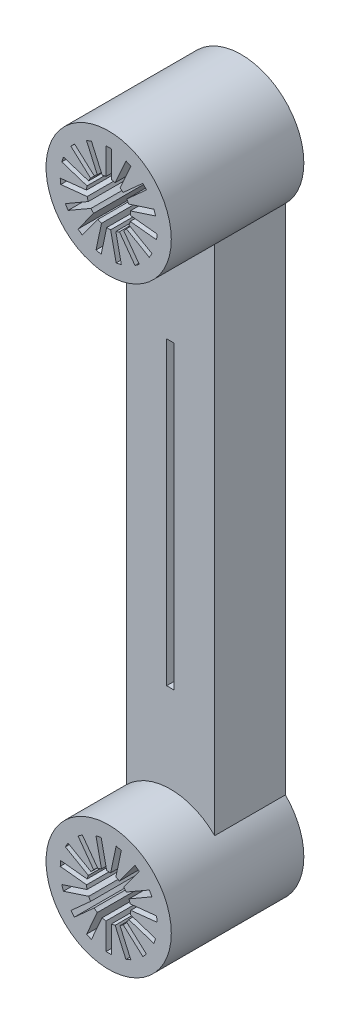
from build123d import *

# Parameters (mm, degrees)
SKETCH1_W                = 12.7
SKETCH1_H                = 86.36
BOSS_EXTRUDE1_DEPTH      = 10.16
SKETCH2_W                = 1.0668
SKETCH2_H                = 43.18
CUT_EXTRUDE1_DEPTH       = 5.08
BOSS_EXTRUDE3_START      = -10.16
SKETCH12_R               = 9
BOSS_EXTRUDE3_DEPTH      = 19.05
SKETCH13_R               = 3.175
CUT_EXTRUDE3_DEPTH       = 57.273038837
SKETCH15_W               = 0.762
SKETCH15_H               = 3.81
CUT_EXTRUDE4_DEPTH       = 57.273038837
CIRPATTERN1_COUNT        = 15
MIRROR2_COPY_1_SKETCH_W  = 0.762
MIRROR2_COPY_1_SKETCH_H  = 3.81
MIRROR2_COPY_1_DEPTH     = 57.273038837
MIRROR2_COPY_2_SKETCH_W  = 0.762
MIRROR2_COPY_2_SKETCH_H  = 3.81
MIRROR2_COPY_2_DEPTH     = 57.273038837
MIRROR2_COPY_3_SKETCH_W  = 0.762
MIRROR2_COPY_3_SKETCH_H  = 3.81
MIRROR2_COPY_3_DEPTH     = 57.273038837
MIRROR2_COPY_4_SKETCH_W  = 0.762
MIRROR2_COPY_4_SKETCH_H  = 3.81
MIRROR2_COPY_4_DEPTH     = 57.273038837
MIRROR2_COPY_5_SKETCH_W  = 0.762
MIRROR2_COPY_5_SKETCH_H  = 3.81
MIRROR2_COPY_5_DEPTH     = 57.273038837
MIRROR2_COPY_6_SKETCH_W  = 0.762
MIRROR2_COPY_6_SKETCH_H  = 3.81
MIRROR2_COPY_6_DEPTH     = 57.273038837
MIRROR2_COPY_7_SKETCH_W  = 0.762
MIRROR2_COPY_7_SKETCH_H  = 3.81
MIRROR2_COPY_7_DEPTH     = 57.273038837
MIRROR2_COPY_8_SKETCH_W  = 0.762
MIRROR2_COPY_8_SKETCH_H  = 3.81
MIRROR2_COPY_8_DEPTH     = 57.273038837
MIRROR2_COPY_9_SKETCH_W  = 0.762
MIRROR2_COPY_9_SKETCH_H  = 3.81
MIRROR2_COPY_9_DEPTH     = 57.273038837
MIRROR2_COPY_10_SKETCH_W = 0.762
MIRROR2_COPY_10_SKETCH_H = 3.81
MIRROR2_COPY_10_DEPTH    = 57.273038837
MIRROR2_COPY_11_SKETCH_W = 0.762
MIRROR2_COPY_11_SKETCH_H = 3.81
MIRROR2_COPY_11_DEPTH    = 57.273038837
MIRROR2_COPY_12_SKETCH_W = 0.762
MIRROR2_COPY_12_SKETCH_H = 3.81
MIRROR2_COPY_12_DEPTH    = 57.273038837
MIRROR2_COPY_13_SKETCH_W = 0.762
MIRROR2_COPY_13_SKETCH_H = 3.81
MIRROR2_COPY_13_DEPTH    = 57.273038837
MIRROR2_COPY_14_SKETCH_W = 0.762
MIRROR2_COPY_14_SKETCH_H = 3.81
MIRROR2_COPY_14_DEPTH    = 57.273038837
M6_CLEARANCE_HOLE1_D     = 7
M6_CLEARANCE_HOLE1_DEPTH = 2.54


with BuildPart() as part:
    # Sketch1 → Boss-Extrude1 (new body)
    with BuildSketch(Plane.XY):
        Rectangle(SKETCH1_W, SKETCH1_H)
    extrude(amount=BOSS_EXTRUDE1_DEPTH)

    # Sketch2 → Cut-Extrude1 (cut)
    with BuildSketch(Plane.XY.offset(10.16)):
        with Locations((-0.0254, 0)):
            Rectangle(SKETCH2_W, SKETCH2_H)
    extrude(amount=-CUT_EXTRUDE1_DEPTH, mode=Mode.SUBTRACT)

    # Sketch12 → Boss-Extrude3 (add)
    with BuildSketch(Plane.XY.offset(10.16).offset(BOSS_EXTRUDE3_START)):
        with Locations((0, 43.18)):
            Circle(SKETCH12_R)
    boss_extrude3 = extrude(amount=BOSS_EXTRUDE3_DEPTH)

    # Sketch13 → Cut-Extrude3 (cut, through all)
    with BuildSketch(Plane.XY.offset(19.05)):
        with Locations((0, 43.18)):
            Circle(SKETCH13_R)
    cut_extrude3 = extrude(amount=-CUT_EXTRUDE3_DEPTH, mode=Mode.SUBTRACT)

    # Sketch15 → Cut-Extrude4 (cut, through all)
    with BuildSketch(Plane.XY.offset(19.05)):
        with Locations((0, 48.237057106)):
            Rectangle(SKETCH15_W, SKETCH15_H)
    cut_extrude4 = extrude(amount=-CUT_EXTRUDE4_DEPTH, mode=Mode.SUBTRACT)

    # CirPattern1: Cut-Extrude4 ×15 about axis
    cirpattern1_axis = Axis((0, 43.18, 0), (0, 0, 1))
    for i in range(1, CIRPATTERN1_COUNT):
        add(cut_extrude4.rotate(cirpattern1_axis, i * 360 / CIRPATTERN1_COUNT), mode=Mode.SUBTRACT)

    # Mirror2: Boss-Extrude3, Cut-Extrude3, Cut-Extrude4 across plane
    add(boss_extrude3.mirror(Plane.ZX))
    add(cut_extrude3.mirror(Plane.ZX), mode=Mode.SUBTRACT)
    add(cut_extrude4.mirror(Plane.ZX), mode=Mode.SUBTRACT)

    # Mirror2 copy 1 sketch → Mirror2 copy 1 (cut, through all)
    with BuildSketch(Plane(origin=(17.562888248, -3.733107139, 19.05), x_dir=(0.9135454576426009, -0.4067366430758002, 0), z_dir=(0, 0, 1))):
        with Locations((0, -48.237057106)):
            Rectangle(MIRROR2_COPY_1_SKETCH_W, MIRROR2_COPY_1_SKETCH_H)
    extrude(amount=-MIRROR2_COPY_1_DEPTH, mode=Mode.SUBTRACT)

    # Mirror2 copy 2 sketch → Mirror2 copy 2 (cut, through all)
    with BuildSketch(Plane(origin=(32.088993564, -14.286940417, 19.05), x_dir=(0.6691306063588582, -0.7431448254773942, 0), z_dir=(0, 0, 1))):
        with Locations((0, -48.237057106)):
            Rectangle(MIRROR2_COPY_2_SKETCH_W, MIRROR2_COPY_2_SKETCH_H)
    extrude(amount=-MIRROR2_COPY_2_DEPTH, mode=Mode.SUBTRACT)

    # Mirror2 copy 3 sketch → Mirror2 copy 3 (cut, through all)
    with BuildSketch(Plane(origin=(41.066620374, -29.836646183, 19.05), x_dir=(0.30901699437494745, -0.9510565162951535, 0), z_dir=(0, 0, 1))):
        with Locations((0, -48.237057106)):
            Rectangle(MIRROR2_COPY_3_SKETCH_W, MIRROR2_COPY_3_SKETCH_H)
    extrude(amount=-MIRROR2_COPY_3_DEPTH, mode=Mode.SUBTRACT)

    # Mirror2 copy 4 sketch → Mirror2 copy 4 (cut, through all)
    with BuildSketch(Plane(origin=(42.943455442, -47.693539044, 19.05), x_dir=(-0.10452846326765355, -0.9945218953682733, 0), z_dir=(0, 0, 1))):
        with Locations((0, -48.237057106)):
            Rectangle(MIRROR2_COPY_4_SKETCH_W, MIRROR2_COPY_4_SKETCH_H)
    extrude(amount=-MIRROR2_COPY_4_DEPTH, mode=Mode.SUBTRACT)

    # Mirror2 copy 5 sketch → Mirror2 copy 5 (cut, through all)
    with BuildSketch(Plane(origin=(37.394976935, -64.77, 19.05), x_dir=(-0.4999999999999998, -0.8660254037844387, 0), z_dir=(0, 0, 1))):
        with Locations((0, -48.237057106)):
            Rectangle(MIRROR2_COPY_5_SKETCH_W, MIRROR2_COPY_5_SKETCH_H)
    extrude(amount=-MIRROR2_COPY_5_DEPTH, mode=Mode.SUBTRACT)

    # Mirror2 copy 6 sketch → Mirror2 copy 6 (cut, through all)
    with BuildSketch(Plane(origin=(25.380567194, -78.113353817, 19.05), x_dir=(-0.8090169943749473, -0.5877852522924732, 0), z_dir=(0, 0, 1))):
        with Locations((0, -48.237057106)):
            Rectangle(MIRROR2_COPY_6_SKETCH_W, MIRROR2_COPY_6_SKETCH_H)
    extrude(amount=-MIRROR2_COPY_6_DEPTH, mode=Mode.SUBTRACT)

    # Mirror2 copy 7 sketch → Mirror2 copy 7 (cut, through all)
    with BuildSketch(Plane(origin=(8.97762681, -85.4164134, 19.05), x_dir=(-0.9781476007338057, -0.20791169081775931, 0), z_dir=(0, 0, 1))):
        with Locations((0, -48.237057106)):
            Rectangle(MIRROR2_COPY_7_SKETCH_W, MIRROR2_COPY_7_SKETCH_H)
    extrude(amount=-MIRROR2_COPY_7_DEPTH, mode=Mode.SUBTRACT)

    # Mirror2 copy 8 sketch → Mirror2 copy 8 (cut, through all)
    with BuildSketch(Plane(origin=(-8.97762681, -85.4164134, 19.05), x_dir=(-0.9781476007338056, 0.2079116908177595, 0), z_dir=(0, 0, 1))):
        with Locations((0, -48.237057106)):
            Rectangle(MIRROR2_COPY_8_SKETCH_W, MIRROR2_COPY_8_SKETCH_H)
    extrude(amount=-MIRROR2_COPY_8_DEPTH, mode=Mode.SUBTRACT)

    # Mirror2 copy 9 sketch → Mirror2 copy 9 (cut, through all)
    with BuildSketch(Plane(origin=(-25.380567194, -78.113353817, 19.05), x_dir=(-0.8090169943749476, 0.587785252292473, 0), z_dir=(0, 0, 1))):
        with Locations((0, -48.237057106)):
            Rectangle(MIRROR2_COPY_9_SKETCH_W, MIRROR2_COPY_9_SKETCH_H)
    extrude(amount=-MIRROR2_COPY_9_DEPTH, mode=Mode.SUBTRACT)

    # Mirror2 copy 10 sketch → Mirror2 copy 10 (cut, through all)
    with BuildSketch(Plane(origin=(-37.394976935, -64.77, 19.05), x_dir=(-0.5000000000000004, 0.8660254037844384, 0), z_dir=(0, 0, 1))):
        with Locations((0, -48.237057106)):
            Rectangle(MIRROR2_COPY_10_SKETCH_W, MIRROR2_COPY_10_SKETCH_H)
    extrude(amount=-MIRROR2_COPY_10_DEPTH, mode=Mode.SUBTRACT)

    # Mirror2 copy 11 sketch → Mirror2 copy 11 (cut, through all)
    with BuildSketch(Plane(origin=(-42.943455442, -47.693539044, 19.05), x_dir=(-0.10452846326765336, 0.9945218953682734, 0), z_dir=(0, 0, 1))):
        with Locations((0, -48.237057106)):
            Rectangle(MIRROR2_COPY_11_SKETCH_W, MIRROR2_COPY_11_SKETCH_H)
    extrude(amount=-MIRROR2_COPY_11_DEPTH, mode=Mode.SUBTRACT)

    # Mirror2 copy 12 sketch → Mirror2 copy 12 (cut, through all)
    with BuildSketch(Plane(origin=(-41.066620374, -29.836646183, 19.05), x_dir=(0.30901699437494723, 0.9510565162951536, 0), z_dir=(0, 0, 1))):
        with Locations((0, -48.237057106)):
            Rectangle(MIRROR2_COPY_12_SKETCH_W, MIRROR2_COPY_12_SKETCH_H)
    extrude(amount=-MIRROR2_COPY_12_DEPTH, mode=Mode.SUBTRACT)

    # Mirror2 copy 13 sketch → Mirror2 copy 13 (cut, through all)
    with BuildSketch(Plane(origin=(-32.088993564, -14.286940417, 19.05), x_dir=(0.6691306063588578, 0.7431448254773946, 0), z_dir=(0, 0, 1))):
        with Locations((0, -48.237057106)):
            Rectangle(MIRROR2_COPY_13_SKETCH_W, MIRROR2_COPY_13_SKETCH_H)
    extrude(amount=-MIRROR2_COPY_13_DEPTH, mode=Mode.SUBTRACT)

    # Mirror2 copy 14 sketch → Mirror2 copy 14 (cut, through all)
    with BuildSketch(Plane(origin=(-17.562888248, -3.733107139, 19.05), x_dir=(0.913545457642601, 0.40673664307580015, 0), z_dir=(0, 0, 1))):
        with Locations((0, -48.237057106)):
            Rectangle(MIRROR2_COPY_14_SKETCH_W, MIRROR2_COPY_14_SKETCH_H)
    extrude(amount=-MIRROR2_COPY_14_DEPTH, mode=Mode.SUBTRACT)

    # M6 Clearance Hole1
    with Locations(Plane(origin=(0, 0, 0), x_dir=(-1, 0, 0), z_dir=(0, 0, -1))):
        with Locations((0, 0)):
            Hole(M6_CLEARANCE_HOLE1_D / 2, depth=M6_CLEARANCE_HOLE1_DEPTH)


solid = part.part
